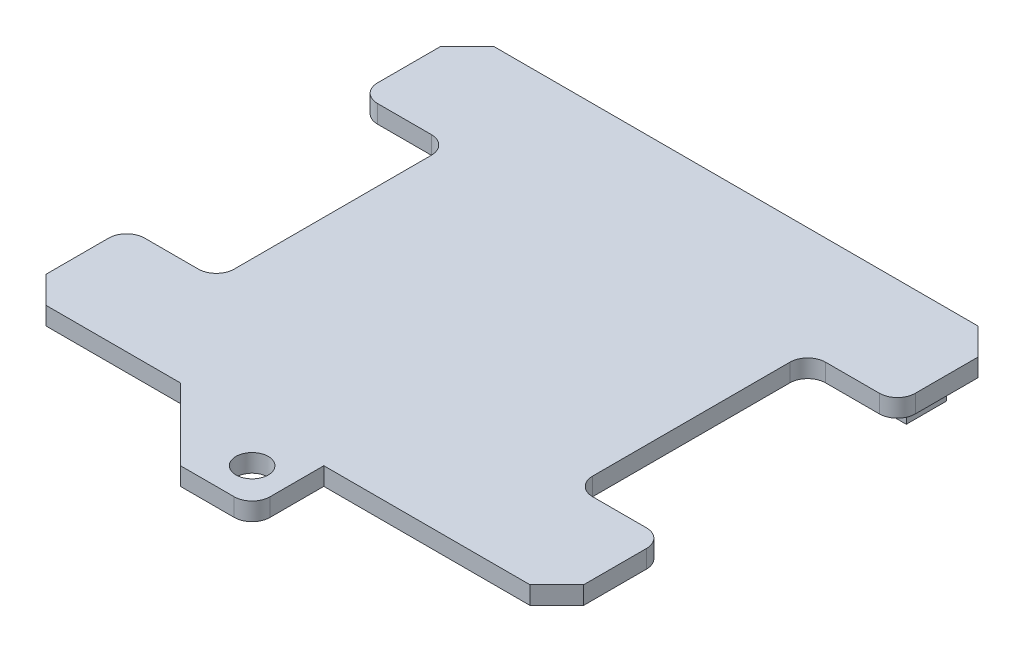
from build123d import *

# Parameters (mm, degrees)
SKETCH1_W           = 60
SKETCH1_H           = 50
BOSS_EXTRUDE1_DEPTH = 2
CHAMFER1_SIZE       = 3
BOSS_EXTRUDE2_DEPTH = 3
SKETCH3_R           = 2
SKETCH3_R_2         = 1.8
BOSS_EXTRUDE3_DEPTH = 2
SKETCH4_W           = 10
SKETCH4_H           = 26
CUT_EXTRUDE1_DEPTH  = 79.262379212
FILLET1_R           = 2


with BuildPart() as part:
    # Sketch1 → Boss-Extrude1 (new body)
    with BuildSketch(Plane(origin=(0, 0, 0), x_dir=(1, 0, 0), z_dir=(0, 1, 0))):
        with Locations((30, 25)):
            Rectangle(SKETCH1_W, SKETCH1_H)
    extrude(amount=BOSS_EXTRUDE1_DEPTH)

    # Chamfer1
    chamfer1_edges = [part.edges().sort_by_distance(p)[0] for p in [
        (0, 1, -50),
        (60, 1, -50),
        (60, 1, 0),
        (0, 1, 0),
    ]]
    chamfer(chamfer1_edges, length=CHAMFER1_SIZE)

    # Sketch2 → Boss-Extrude2 (add)
    with BuildSketch(Plane.XZ):
        Polygon((4.5, -41.5), (2.5, -41.5), (2.5, -45.964466094), (4.035533906, -47.5), (55.964466094, -47.5), (57.5, -45.964466094), (57.5, -41.5), (55.5, -41.5), (55.5, -45.136038969), (55.136038969, -45.5), (4.863961031, -45.5), (4.5, -45.136038969), align=None)
    extrude(amount=BOSS_EXTRUDE2_DEPTH)

    # Sketch3 → Boss-Extrude3 (add)
    # profile 1 of 2: a face of its own
    with BuildSketch(Plane(origin=(0, 2, 0), x_dir=(1, 0, 0), z_dir=(0, 1, 0))):
        with BuildLine():
            Line((18, 0), (26, -8))
            Line((26, -8), (32, -8))
            ThreePointArc((32, -8), (33.414213562, -7.414213562), (34, -6))
            Line((34, -6), (34, 0))
            Line((34, 0), (18, 0))
        make_face()
        with Locations((30, -4)):
            Circle(SKETCH3_R, mode=Mode.SUBTRACT)
    # profile 2 of 2: a face of its own
    with BuildSketch(Plane(origin=(0, 2, 0), x_dir=(1, 0, 0), z_dir=(0, 1, 0))):
        with Locations((30, -4)):
            Circle(SKETCH3_R)
        with Locations(Location((30, -4, 0), (0, 0, 270))):
            Circle(SKETCH3_R_2, mode=Mode.SUBTRACT)
    extrude(amount=-BOSS_EXTRUDE3_DEPTH)

    # Sketch4 → Cut-Extrude1 (cut, through all)
    with BuildSketch(Plane(origin=(0, 2, 0), x_dir=(1, 0, 0), z_dir=(0, 1, 0))):
        with Locations((5, 25)):
            Rectangle(SKETCH4_W, SKETCH4_H)
        with Locations((55, 25)):
            Rectangle(SKETCH4_W, SKETCH4_H)
    extrude(amount=-CUT_EXTRUDE1_DEPTH, mode=Mode.SUBTRACT)

    # Fillet1
    fillet1_edges = [part.edges().sort_by_distance(p)[0] for p in [
        (0, 1, -12),
        (0, 1, -38),
        (10, 1, -38),
        (10, 1, -12),
        (60, 1, -38),
        (60, 1, -12),
        (50, 1, -12),
        (50, 1, -38),
    ]]
    fillet(fillet1_edges, radius=FILLET1_R)


solid = part.part
